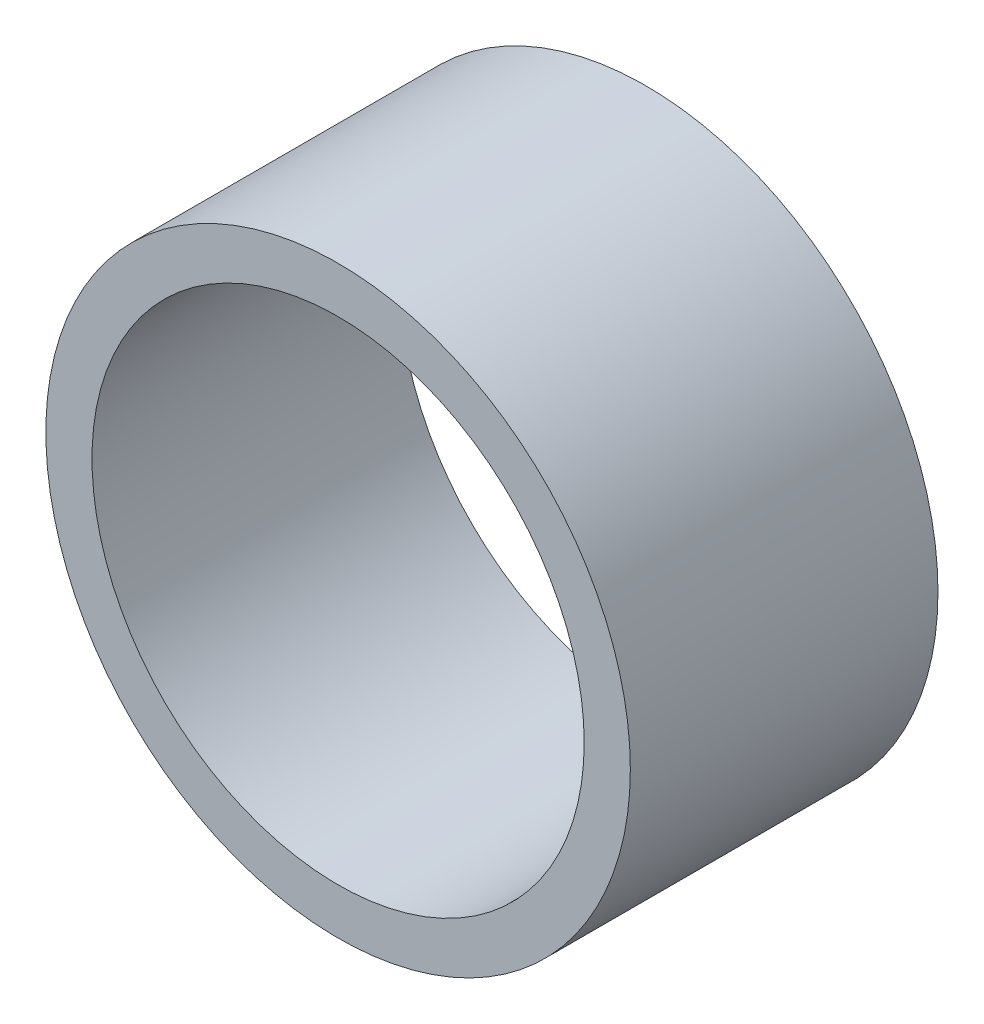
from build123d import *

# Parameters (mm, degrees)
CROQUIS1_R              = 9.5
CROQUIS1_R_2            = 8
SALIENTE_EXTRUIR1_DEPTH = 10


with BuildPart() as part:
    # Croquis1 → Saliente-Extruir1 (new body)
    with BuildSketch(Plane(origin=(0, 0, 0), x_dir=(0, 1, 0), z_dir=(0, 0, 1))):
        with Locations(Location((0, 0, 0), (0, 0, 270))):
            Circle(CROQUIS1_R)
        with Locations(Location((0, 0, 0), (0, 0, 270))):
            Circle(CROQUIS1_R_2, mode=Mode.SUBTRACT)
    extrude(amount=SALIENTE_EXTRUIR1_DEPTH)


solid = part.part
